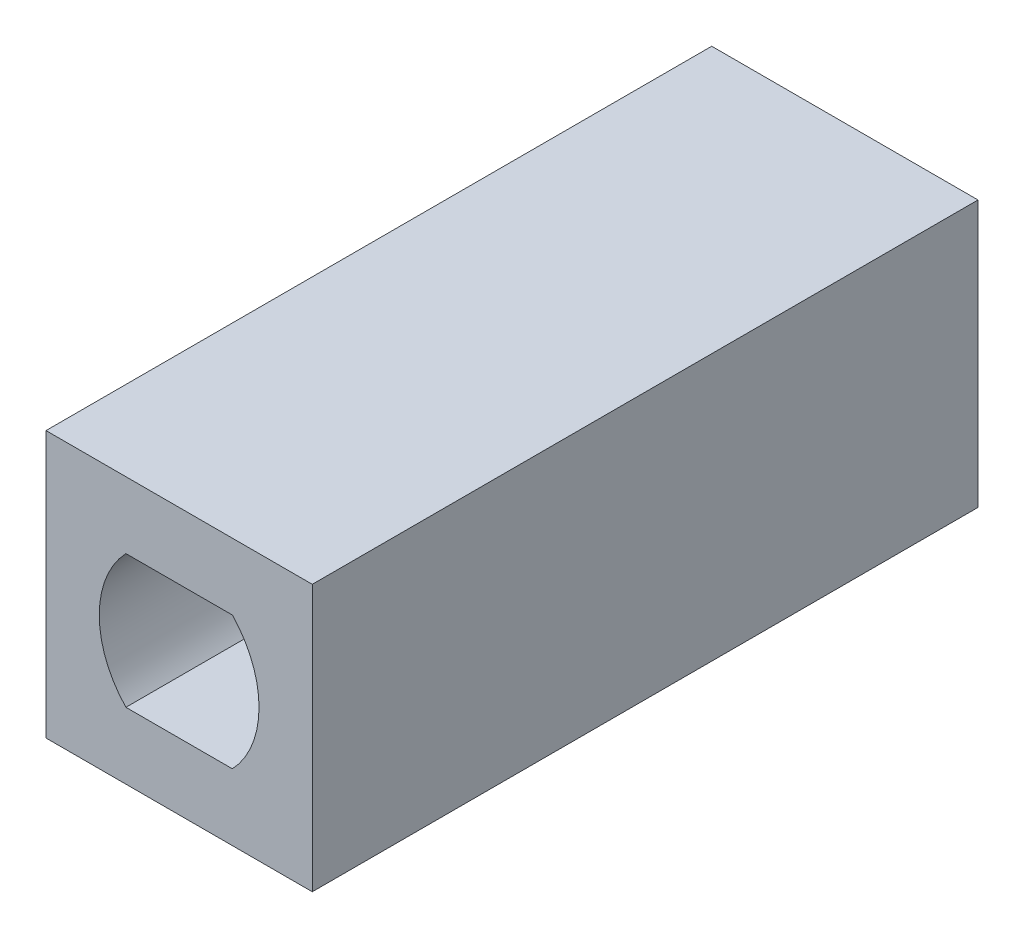
from build123d import *

# Parameters (mm, degrees)
SKETCH_1_W          = 20
SKETCH_1_H          = 20
EXTRUDE_1_DEPTH     = 50
CUT_EXTRUDE_1_DEPTH = 50


with BuildPart() as part:
    # 草圖1 → 填料-伸長1 (new body)
    with BuildSketch(Plane.XY):
        Rectangle(SKETCH_1_W, SKETCH_1_H)
    extrude(amount=EXTRUDE_1_DEPTH)

    # 草圖2 → 除料-伸長1 (cut)
    with BuildSketch(Plane.XY):
        with BuildLine():
            Line((-4, 5), (4, 5))
            ThreePointArc((4, 5), (6, 0), (4, -5))
            Line((4, -5), (-4, -5))
            ThreePointArc((-4, -5), (-6, 0), (-4, 5))
        make_face()
    extrude(amount=CUT_EXTRUDE_1_DEPTH, mode=Mode.SUBTRACT)


solid = part.part
